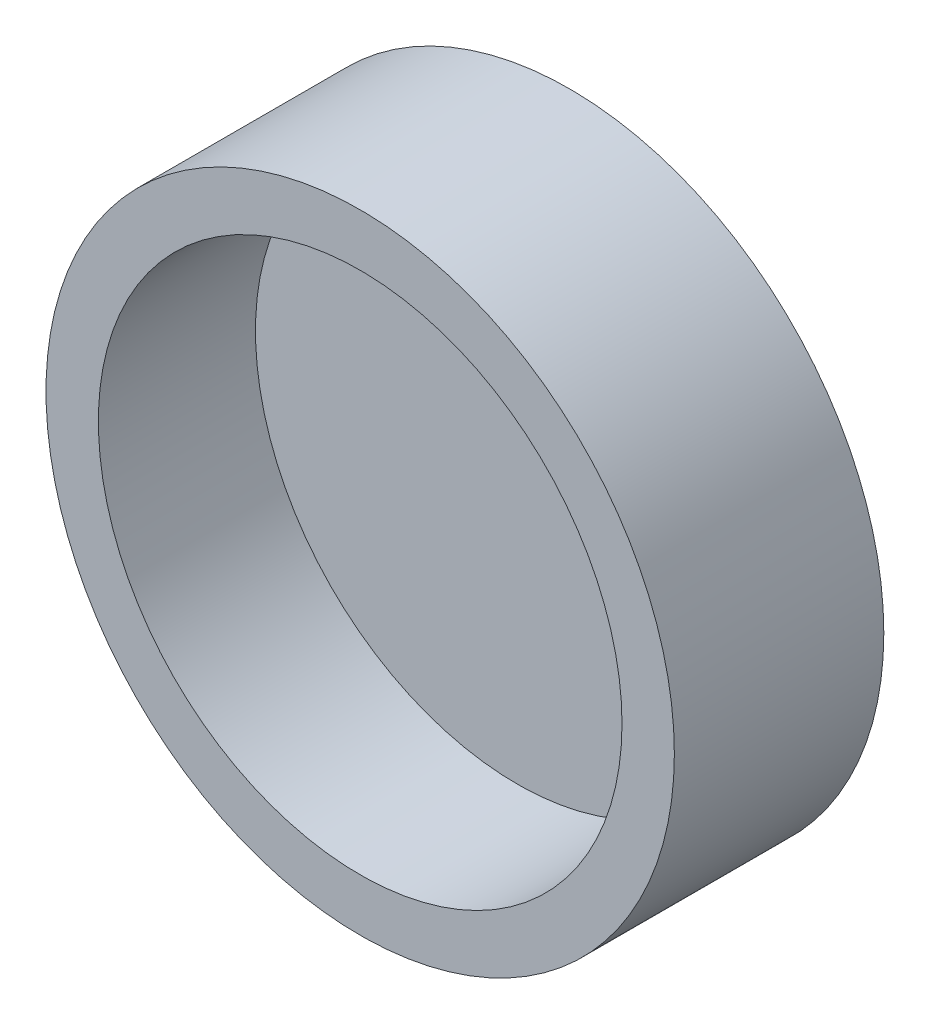
from build123d import *

# Parameters (mm, degrees)
SKIZZE1_R                       = 60
AUFSATZ_LINEAR_AUSTRAGEN1_DEPTH = 40
SKIZZE2_R                       = 50
SCHNITT_LINEAR_AUSTRAGEN1_DEPTH = 30


with BuildPart() as part:
    # Skizze1 → Aufsatz-Linear austragen1 (new body)
    with BuildSketch(Plane.XY):
        Circle(SKIZZE1_R)
    extrude(amount=AUFSATZ_LINEAR_AUSTRAGEN1_DEPTH)

    # Skizze2 → Schnitt-Linear austragen1 (cut)
    with BuildSketch(Plane.XY.offset(40)):
        Circle(SKIZZE2_R)
    extrude(amount=-SCHNITT_LINEAR_AUSTRAGEN1_DEPTH, mode=Mode.SUBTRACT)


solid = part.part
